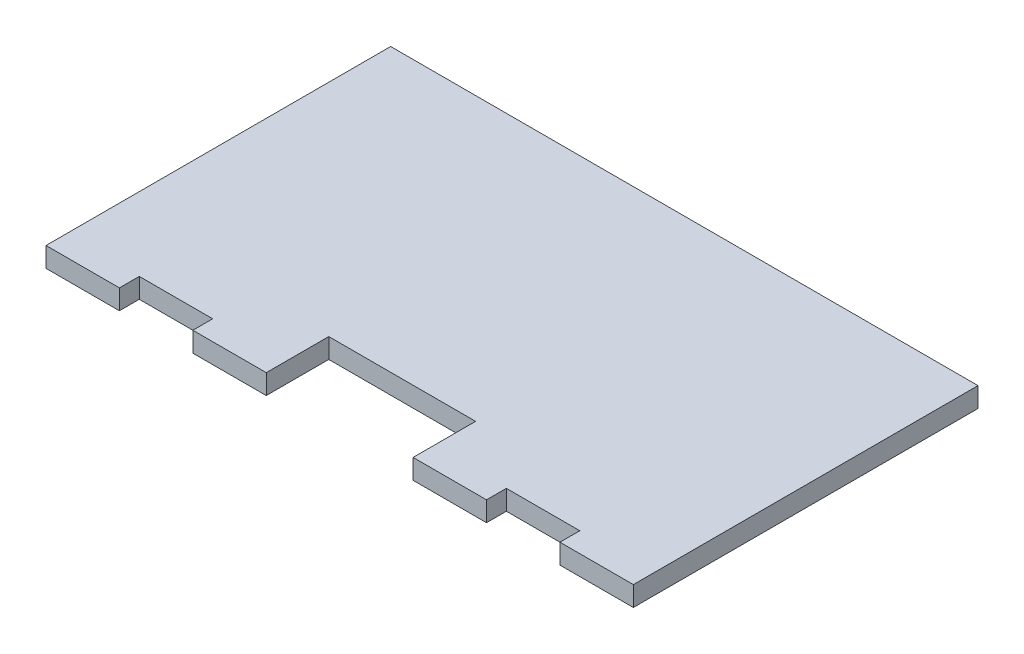
from build123d import *

# Parameters (mm, degrees)
SKETCH1_W           = 288.544
SKETCH1_H           = 169.3164
BOSS_EXTRUDE1_DEPTH = 9.7536
SKETCH2_W           = 36.068
SKETCH2_H           = 9.7536
SKETCH2_H_2         = 30.7086
CUT_EXTRUDE1_DEPTH  = 228.714720508


with BuildPart() as part:
    # Sketch1 → Boss-Extrude1 (new body)
    with BuildSketch(Plane(origin=(0, 0, 0), x_dir=(1, 0, 0), z_dir=(0, 1, 0))):
        with Locations((-45.056976526, -41.490124883)):
            Rectangle(SKETCH1_W, SKETCH1_H)
    extrude(amount=BOSS_EXTRUDE1_DEPTH)

    # Sketch2 → Cut-Extrude1 (cut, through all)
    with BuildSketch(Plane.XZ):
        with Locations((-135.226976526, 121.271524883)):
            Rectangle(SKETCH2_W, SKETCH2_H)
        with Locations((-63.090976526, 110.794024883)):
            Rectangle(SKETCH2_W, SKETCH2_H_2)
        with Locations((-27.022976526, 110.794024883)):
            Rectangle(SKETCH2_W, SKETCH2_H_2)
        with Locations((45.113023474, 121.271524883)):
            Rectangle(SKETCH2_W, SKETCH2_H)
    extrude(amount=-CUT_EXTRUDE1_DEPTH, mode=Mode.SUBTRACT)


solid = part.part
